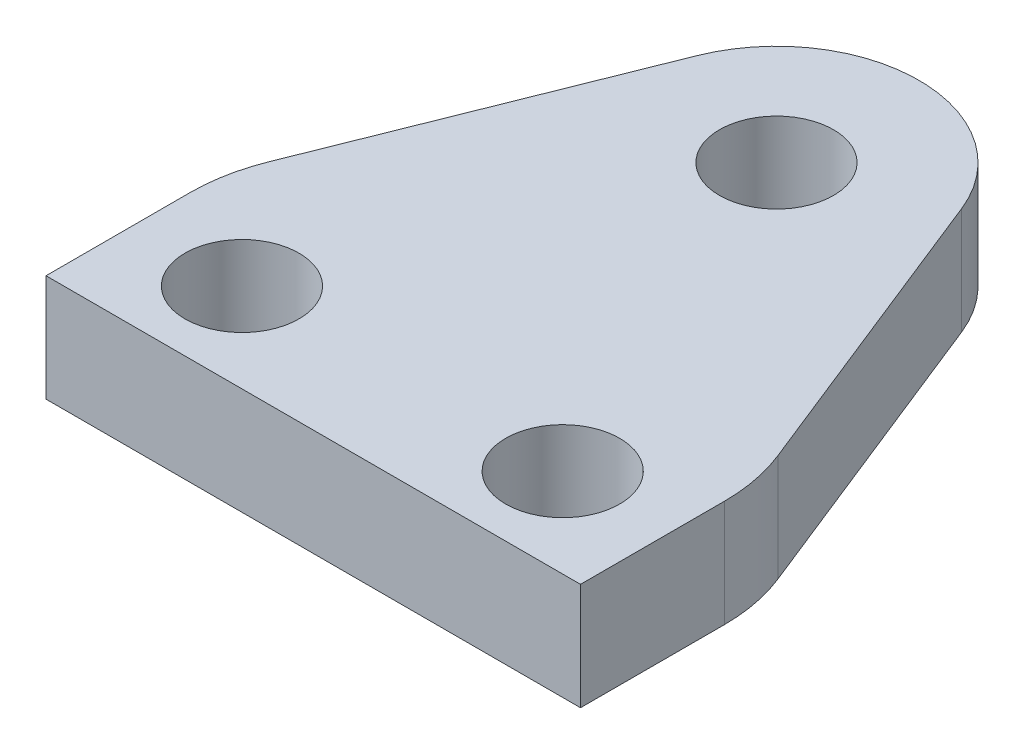
from build123d import *

# Parameters (mm, degrees)
SKETCH1_R           = 1.6
SKETCH1_R_2         = 4
BOSS_EXTRUDE1_DEPTH = 3
FILLET1_R           = 5


with BuildPart() as part:
    # Sketch1 → Boss-Extrude1 (new body)
    # profile 1 of 2: a face of its own
    with BuildSketch(Plane(origin=(0, 0, 0), x_dir=(1, 0, 0), z_dir=(0, 1, 0))):
        with BuildLine():
            Line((0, 5), (0, 0))
            Line((0, 0), (15, 0))
            Line((15, 0), (15, 5))
            Line((15, 5), (11.215004122, 14.482816365))
            ThreePointArc((11.215004122, 14.482816365), (11.428104918, 13.754977983), (11.5, 13))
            ThreePointArc((11.5, 13), (6.745022017, 9.071895082), (3.784995878, 14.482816365))
            Line((3.784995878, 14.482816365), (0, 5))
        make_face()
        with Locations(Location((3, 2.5, 0), (0, 0, 270))):
            Circle(SKETCH1_R, mode=Mode.SUBTRACT)
        with Locations(Location((12, 2.5, 0), (0, 0, 270))):
            Circle(SKETCH1_R, mode=Mode.SUBTRACT)
    # profile 2 of 2: a face of its own
    with BuildSketch(Plane(origin=(0, 0, 0), x_dir=(1, 0, 0), z_dir=(0, 1, 0))):
        with Locations((7.5, 13)):
            Circle(SKETCH1_R_2)
        with Locations(Location((7.5, 13, 0), (0, 0, 270))):
            Circle(SKETCH1_R, mode=Mode.SUBTRACT)
    extrude(amount=BOSS_EXTRUDE1_DEPTH)

    # Fillet1
    fillet1_edges = [part.edges().sort_by_distance(p)[0] for p in [
        (15, 1.5, -5),
        (0, 1.5, -5),
    ]]
    fillet(fillet1_edges, radius=FILLET1_R)


solid = part.part
